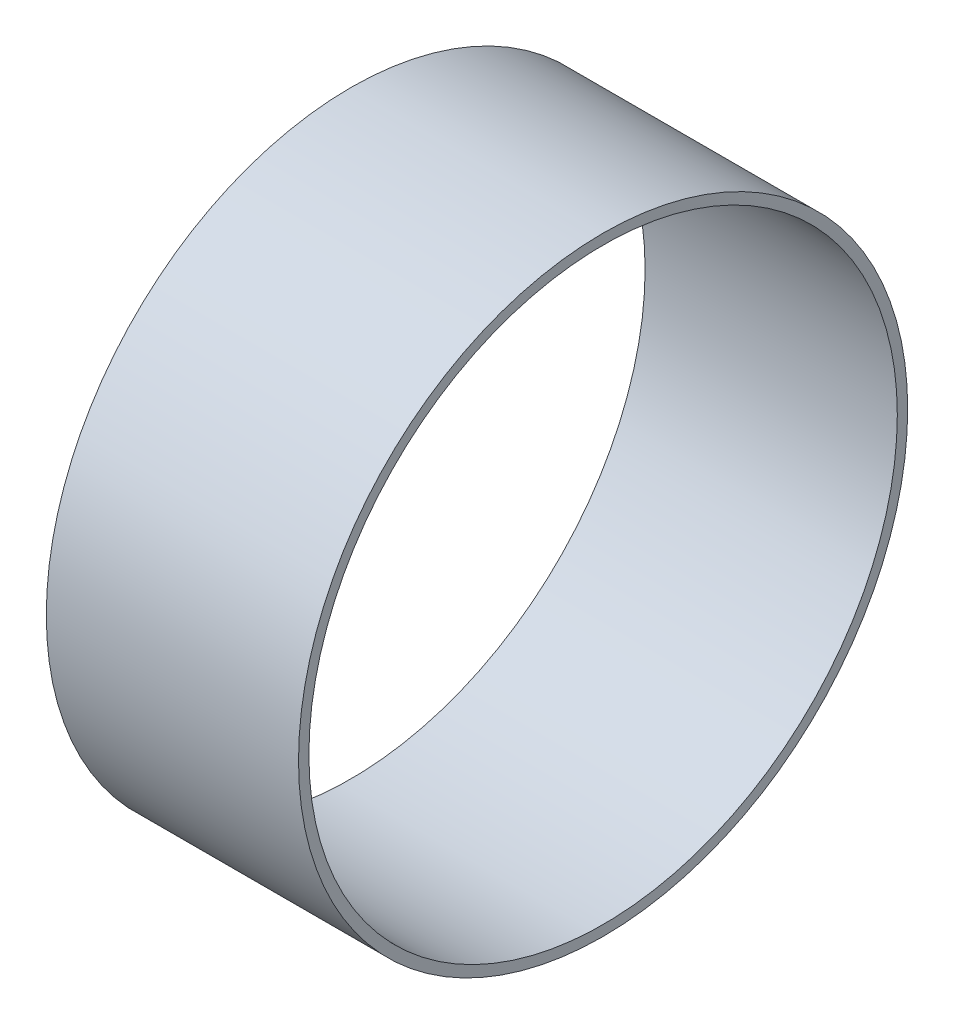
from build123d import *

# Parameters (mm, degrees)
SKETCH1_W = 19.287499954
SKETCH1_H = 0.79375


with BuildPart() as part:
    # Sketch1 → Revolve1 (revolve)
    with BuildSketch(Plane(origin=(0, 0, 0), x_dir=(1, 0, 0), z_dir=(0, 1, 0))):
        with Locations((-90.256250057, 22.896875)):
            Rectangle(SKETCH1_W, SKETCH1_H)
    revolve(axis=Axis((-79.648125082, 0, 0), (-1, 0, 0)))


solid = part.part
